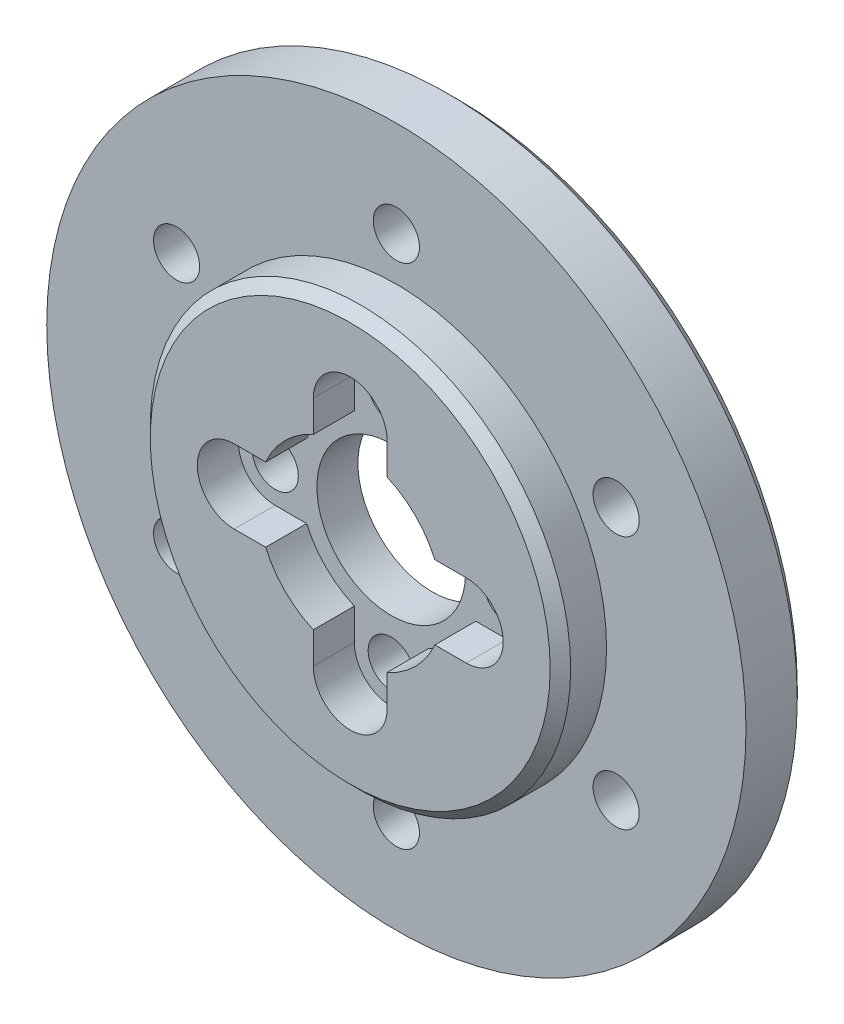
from build123d import *
from build123d.topology import SkipClean

# Parameters (mm, degrees)
SKETCH1_R               = 34.1
BOSS_EXTRUDE1_DEPTH     = 1.75
SKETCH4_R               = 28.5
BOSS_EXTRUDE2_DEPTH     = 2
SKETCH5_R               = 34.1
SKETCH5_R_2             = 16.25
BOSS_EXTRUDE3_DEPTH     = 2.5
CUT_EXTRUDE2_DEPTH      = 49.596501932
CUT_EXTRUDE2_DEPTH_BACK = 49.596501932
SKETCH3_R               = 2.25
CUT_EXTRUDE1_DEPTH      = 49.596501932
CUT_EXTRUDE1_DEPTH_BACK = 49.596501932
SKETCH2_R               = 7.25
SKETCH7_R               = 20.5
SKETCH7_R_2             = 2.25
SKETCH7_R_3             = 7.25
BOSS_EXTRUDE4_DEPTH     = 2.5
BOSS_EXTRUDE5_START     = 2
SKETCH8_R               = 34.1
SKETCH8_R_2             = 28.5
BOSS_EXTRUDE5_DEPTH     = 2
SKETCH10_R              = 34.1
SKETCH10_R_2            = 20.5
CUT_EXTRUDE4_DEPTH      = 2
CUT_EXTRUDE5_DEPTH      = 4
SKETCH6_R               = 2.25
CUT_EXTRUDE3_DEPTH      = 50.354533733
SKETCH12_R              = 3.75
CUT_EXTRUDE6_DEPTH      = 2
CIRPATTERN1_COUNT       = 6
CHAMFER1_SIZE           = 1


with BuildPart() as part:
    # Sketch1 → Boss-Extrude1 (new, symmetric)
    with BuildSketch(Plane.XY):
        Circle(SKETCH1_R)
    extrude(amount=BOSS_EXTRUDE1_DEPTH, both=True)

    # Sketch4 → Boss-Extrude2 (add)
    with BuildSketch(Plane.XY.offset(1.75)):
        Circle(SKETCH4_R)
    extrude(amount=BOSS_EXTRUDE2_DEPTH)

    # Sketch5 → Boss-Extrude3 (add)
    with BuildSketch(Plane(origin=(0, 0, -1.75), x_dir=(-1, 0, 0), z_dir=(0, 0, -1))):
        Circle(SKETCH5_R)
        Circle(SKETCH5_R_2, mode=Mode.SUBTRACT)
    extrude(amount=BOSS_EXTRUDE3_DEPTH)

    # Sketch3 → Cut-Extrude2 (cut, two sides: drawn at the far end of the back side and taken through both)
    with BuildSketch(Plane.XY.offset(1.75).offset(-CUT_EXTRUDE2_DEPTH_BACK)):
        with Locations((0, 11.3137085)):
            Circle(SKETCH3_R)
        with Locations((11.3137085, 0)):
            Circle(SKETCH3_R)
        with Locations((0, -11.3137085)):
            Circle(SKETCH3_R)
        with Locations((-11.3137085, 0)):
            Circle(SKETCH3_R)
    extrude(amount=CUT_EXTRUDE2_DEPTH + CUT_EXTRUDE2_DEPTH_BACK, mode=Mode.SUBTRACT)

    # Sketch2 → Cut-Extrude1 (cut, two sides: drawn at the far end of the back side and taken through both)
    with BuildSketch(Plane.XY.offset(1.75).offset(-CUT_EXTRUDE1_DEPTH_BACK)):
        Circle(SKETCH2_R)
    extrude(amount=CUT_EXTRUDE1_DEPTH + CUT_EXTRUDE1_DEPTH_BACK, mode=Mode.SUBTRACT)

    # Sketch7 → Boss-Extrude4 (add)
    with BuildSketch(Plane.XY.offset(3.75)):
        Circle(SKETCH7_R)
        with Locations((0, -11.3137085)):
            Circle(SKETCH7_R_2, mode=Mode.SUBTRACT)
        with Locations((11.3137085, 0)):
            Circle(SKETCH7_R_2, mode=Mode.SUBTRACT)
        with Locations((0, 11.3137085)):
            Circle(SKETCH7_R_2, mode=Mode.SUBTRACT)
        with Locations((-11.3137085, 0)):
            Circle(SKETCH7_R_2, mode=Mode.SUBTRACT)
        Circle(SKETCH7_R_3, mode=Mode.SUBTRACT)
    extrude(amount=BOSS_EXTRUDE4_DEPTH)

    # Sketch8 → Boss-Extrude5 (add)
    with SkipClean():  # the faces are left unmerged after this step: merging them gives an invalid solid
        with BuildSketch(Plane.XY.offset(1.75).offset(BOSS_EXTRUDE5_START)):
            with Locations(Location((0, 0, 0), (0, 0, 180))):
                Circle(SKETCH8_R)
            Circle(SKETCH8_R_2, mode=Mode.SUBTRACT)
        extrude(amount=-BOSS_EXTRUDE5_DEPTH)

    # Sketch10 → Cut-Extrude4 (cut)
    with BuildSketch(Plane.XY.offset(3.75)):
        with Locations(Location((0, 0, 0), (0, 0, 180))):
            Circle(SKETCH10_R)
        Circle(SKETCH10_R_2, mode=Mode.SUBTRACT)
    extrude(amount=-CUT_EXTRUDE4_DEPTH, mode=Mode.SUBTRACT)

    # Sketch11 → Cut-Extrude5 (cut)
    with BuildSketch(Plane.XY.offset(6.25)):
        with BuildLine():
            Line((-11.3137085, 3.6), (-8.248636251, 3.6))
            ThreePointArc((-8.248636251, 3.6), (-6.363961031, 6.363961031), (-3.6, 8.248636251))
            Line((-3.6, 8.248636251), (-3.6, 11.3137085))
            ThreePointArc((-3.6, 11.3137085), (0, 14.9137085), (3.6, 11.3137085))
            Line((3.6, 11.3137085), (3.6, 8.248636251))
            ThreePointArc((3.6, 8.248636251), (6.363961031, 6.363961031), (8.248636251, 3.6))
            Line((8.248636251, 3.6), (11.3137085, 3.6))
            ThreePointArc((11.3137085, 3.6), (14.9137085, 0), (11.3137085, -3.6))
            Line((11.3137085, -3.6), (8.248636251, -3.6))
            ThreePointArc((8.248636251, -3.6), (6.363961031, -6.363961031), (3.6, -8.248636251))
            Line((3.6, -8.248636251), (3.6, -11.3137085))
            ThreePointArc((3.6, -11.3137085), (0, -14.9137085), (-3.6, -11.3137085))
            Line((-3.6, -11.3137085), (-3.6, -8.248636251))
            ThreePointArc((-3.6, -8.248636251), (-6.363961031, -6.363961031), (-8.248636251, -3.6))
            Line((-8.248636251, -3.6), (-11.3137085, -3.6))
            ThreePointArc((-11.3137085, -3.6), (-14.9137085, 0), (-11.3137085, 3.6))
        make_face()
    extrude(amount=-CUT_EXTRUDE5_DEPTH, mode=Mode.SUBTRACT)

    # Sketch6 → Cut-Extrude3 (cut, symmetric)
    with BuildSketch(Plane.XY.offset(-4.25)):
        with Locations((0, 24.75)):
            Circle(SKETCH6_R)
    cut_extrude3 = extrude(amount=CUT_EXTRUDE3_DEPTH, both=True, mode=Mode.SUBTRACT)

    # Sketch12 → Cut-Extrude6 (cut)
    with BuildSketch(Plane(origin=(0, 0, -4.25), x_dir=(-1, 0, 0), z_dir=(0, 0, -1))):
        with Locations((0, 24.75)):
            Circle(SKETCH12_R)
    cut_extrude6 = extrude(amount=-CUT_EXTRUDE6_DEPTH, mode=Mode.SUBTRACT)

    # CirPattern1: Cut-Extrude3, Cut-Extrude6 ×6 about axis
    cirpattern1_axis = Axis((0, 0, 0), (0, 0, 1))
    add([cut_extrude3.rotate(cirpattern1_axis, i * 360 / CIRPATTERN1_COUNT) for i in range(1, CIRPATTERN1_COUNT)], mode=Mode.SUBTRACT)
    add([cut_extrude6.rotate(cirpattern1_axis, i * 360 / CIRPATTERN1_COUNT) for i in range(1, CIRPATTERN1_COUNT)], mode=Mode.SUBTRACT)

    # Chamfer1
    chamfer1_edges = [part.edges().sort_by_distance(p)[0] for p in [
        (34.1, 0, -4.25),
        (-20.5, 0, 6.25),
    ]]
    chamfer(chamfer1_edges, length=CHAMFER1_SIZE)


solid = part.part
